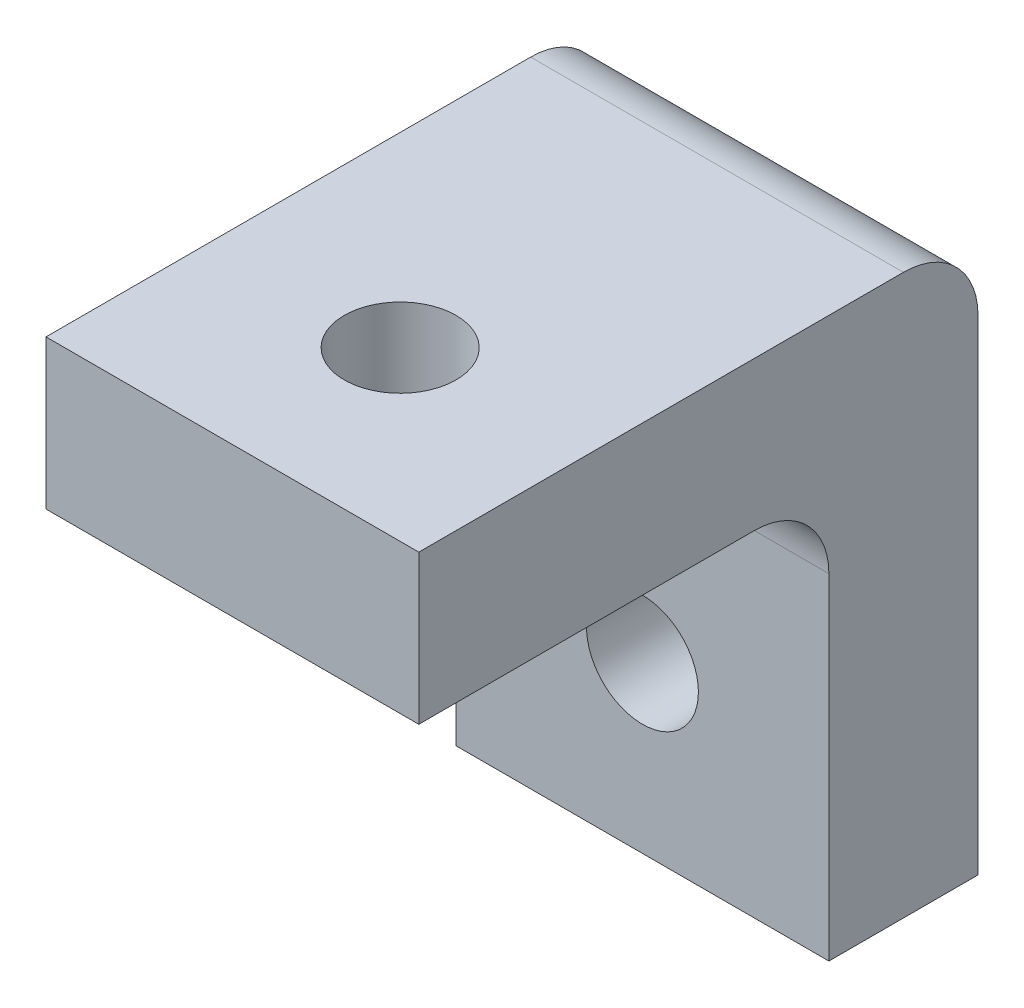
from build123d import *

# Parameters (mm, degrees)
BOSS_EXTRUDE1_DEPTH = 10
SKETCH2_R           = 1.5
CUT_EXTRUDE2_DEPTH  = 22.118712082
SKETCH3_R           = 1.5
CUT_EXTRUDE3_DEPTH  = 22.118712082
FILLET1_R           = 2


with BuildPart() as part:
    # Sketch1 → Boss-Extrude1 (new body)
    with BuildSketch(Plane.YZ):
        with BuildLine():
            Line((0, 0), (0, 15))
            Line((0, 15), (-4, 15))
            Line((-4, 15), (-4, 6))
            ThreePointArc((-4, 6), (-4.585786438, 4.585786438), (-6, 4))
            Line((-6, 4), (-15, 4))
            Line((-15, 4), (-15, 0))
            Line((-15, 0), (0, 0))
        make_face()
    extrude(amount=BOSS_EXTRUDE1_DEPTH)

    # Sketch2 → Cut-Extrude2 (cut, through all)
    with BuildSketch(Plane.XZ.offset(4)):
        with Locations(Location((5, 10.5, 0), (0, 0, 270))):
            Circle(SKETCH2_R)
    extrude(amount=-CUT_EXTRUDE2_DEPTH, mode=Mode.SUBTRACT)

    # Sketch3 → Cut-Extrude3 (cut, through all)
    with BuildSketch(Plane.XY.offset(4)):
        with Locations((5, -10.5)):
            Circle(SKETCH3_R)
    extrude(amount=-CUT_EXTRUDE3_DEPTH, mode=Mode.SUBTRACT)

    # Fillet1
    fillet1_edges = [part.edges().sort_by_distance(p)[0] for p in [
        (5, 0, 0),
    ]]
    fillet(fillet1_edges, radius=FILLET1_R)


solid = part.part
